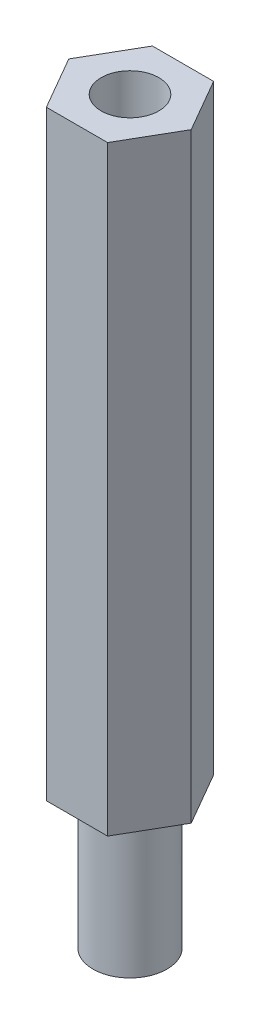
from build123d import *

# Parameters (mm, degrees)
EXTRUDE_1_DEPTH     = 26
SKETCH_6_R          = 1.6
EXTRUDE_2_DEPTH     = 6
SKETCH_7_R          = 1.25
CUT_EXTRUDE_1_DEPTH = 5


with BuildPart() as part:
    # 草图4 → 凸台-拉伸1 (new body)
    with BuildSketch(Plane(origin=(0, 0, 0), x_dir=(1, 0, 0), z_dir=(0, 1, 0))):
        Polygon((1.325, -2.29496732), (2.65, 0), (1.325, 2.29496732), (-1.325, 2.29496732), (-2.65, 0), (-1.325, -2.29496732), align=None)
    extrude(amount=EXTRUDE_1_DEPTH)

    # 草图6 → 凸台-拉伸2 (add)
    with BuildSketch(Plane(origin=(0, 0, 0), x_dir=(-1, 0, 0), z_dir=(0, -1, 0))):
        with Locations(Location((0, 0, 0), (0, 0, 270))):
            Circle(SKETCH_6_R)
    extrude(amount=EXTRUDE_2_DEPTH)

    # 草图7 → 切除-拉伸1 (cut)
    with BuildSketch(Plane(origin=(0, 26, 0), x_dir=(1, 0, 0), z_dir=(0, 1, 0))):
        with Locations(Location((0, 0, 0), (0, 0, 270))):
            Circle(SKETCH_7_R)
    extrude(amount=-CUT_EXTRUDE_1_DEPTH, mode=Mode.SUBTRACT)


solid = part.part
